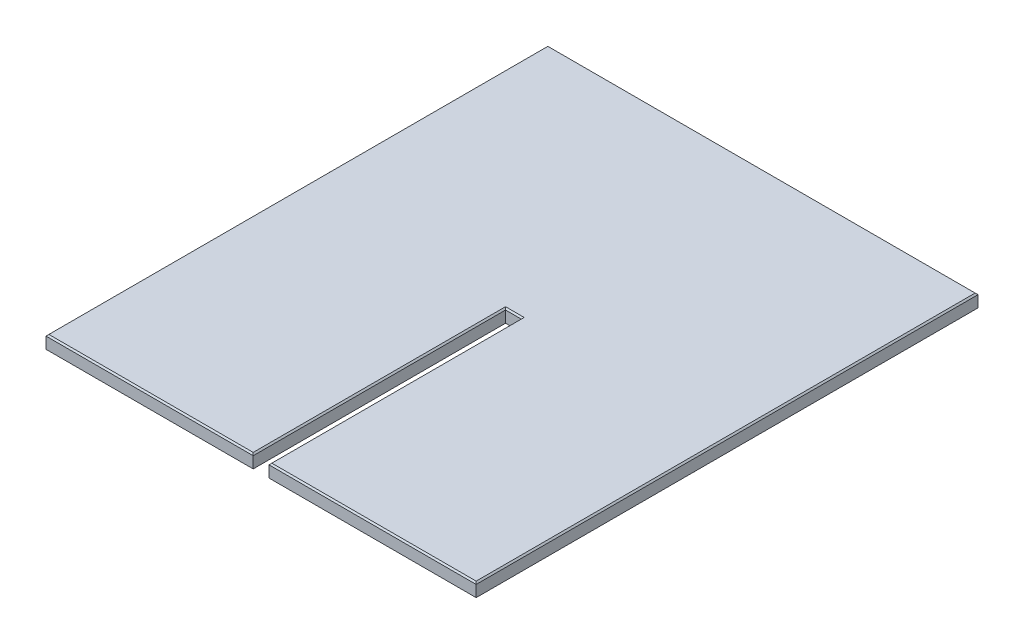
from build123d import *

# Parameters (mm, degrees)
SKETCH1_W                    = 76.2
SKETCH1_H                    = 88.9
BOSS_EXTRUDE1_DEPTH          = 1.27
CUT_EXTRUDE_THIN1_DEPTH      = 59.599181735
CUT_EXTRUDE_THIN1_DEPTH_BACK = 2.794
SKETCH3_W                    = 2.794
SKETCH3_H                    = 44.704
CHAMFER1_SIZE                = 0.254


with BuildPart() as part:
    # Sketch1 → Boss-Extrude1 (new, symmetric)
    with BuildSketch(Plane(origin=(0, 0, 0), x_dir=(1, 0, 0), z_dir=(0, 1, 0))):
        Rectangle(SKETCH1_W, SKETCH1_H)
    extrude(amount=BOSS_EXTRUDE1_DEPTH, both=True)

    # Sketch3 → Cut-Extrude-Thin1 (cut, two sides: drawn at the far end of the back side and taken through both)
    with BuildSketch(Plane(origin=(0, 1.27, 0), x_dir=(1, 0, 0), z_dir=(0, 1, 0)).offset(-CUT_EXTRUDE_THIN1_DEPTH_BACK)):
        with Locations((0, -22.098)):
            Rectangle(SKETCH3_W, SKETCH3_H)
    extrude(amount=CUT_EXTRUDE_THIN1_DEPTH + CUT_EXTRUDE_THIN1_DEPTH_BACK, mode=Mode.SUBTRACT)

    # Chamfer1
    chamfer1_edges = [part.edges().sort_by_distance(p)[0] for p in [
        (38.1, 1.27, 0),
        (19.7485, -1.27, 44.45),
        (0, -1.27, -0.254),
        (1.397, -1.27, 22.098),
        (-1.397, -1.27, 22.098),
        (0, 1.27, -44.45),
        (19.7485, 1.27, 44.45),
        (1.397, 1.27, 22.098),
        (0, 1.27, -0.254),
        (-1.397, 1.27, 22.098),
        (-38.1, 1.27, 0),
        (0, -1.27, -44.45),
        (38.1, -1.27, 0),
        (-19.7485, -1.27, 44.45),
        (-38.1, -1.27, 0),
        (-19.7485, 1.27, 44.45),
    ]]
    chamfer(chamfer1_edges, length=CHAMFER1_SIZE)


solid = part.part
